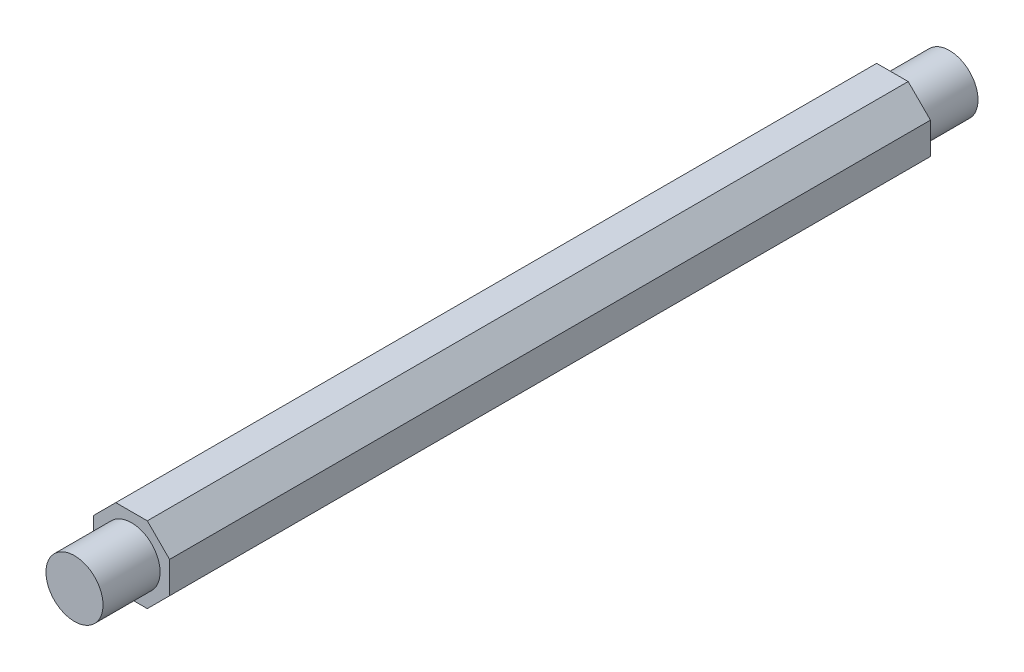
from build123d import *

# Parameters (mm, degrees)
CROQUIS1_R              = 1.5
SALIENTE_EXTRUIR1_DEPTH = 46
SALIENTE_EXTRUIR2_DEPTH = 43
CORTAR_EXTRUIR1_START   = -3
CROQUIS3_R              = 3.153795035
CROQUIS3_R_2            = 1.5
CORTAR_EXTRUIR1_DEPTH   = 3


with BuildPart() as part:
    # Croquis1 → Saliente-Extruir1 (new body)
    with BuildSketch(Plane.XY):
        Circle(CROQUIS1_R)
    extrude(amount=SALIENTE_EXTRUIR1_DEPTH)

    # Croquis2 → Saliente-Extruir2 (add)
    with BuildSketch(Plane.XY.offset(46)):
        Polygon((-0.828427125, -2), (0.828427125, -2), (2, -0.828427125), (2, 0.828427125), (0.828427125, 2), (-0.828427125, 2), (-2, 0.828427125), (-2, -0.828427125), align=None)
    extrude(amount=-SALIENTE_EXTRUIR2_DEPTH)

    # Croquis3 → Cortar-Extruir1 (cut)
    with BuildSketch(Plane.XY.offset(46).offset(CORTAR_EXTRUIR1_START)):
        Circle(CROQUIS3_R)
        with Locations(Location((0, 0, 0), (0, 0, 180))):
            Circle(CROQUIS3_R_2, mode=Mode.SUBTRACT)
    extrude(amount=CORTAR_EXTRUIR1_DEPTH, mode=Mode.SUBTRACT)


solid = part.part
